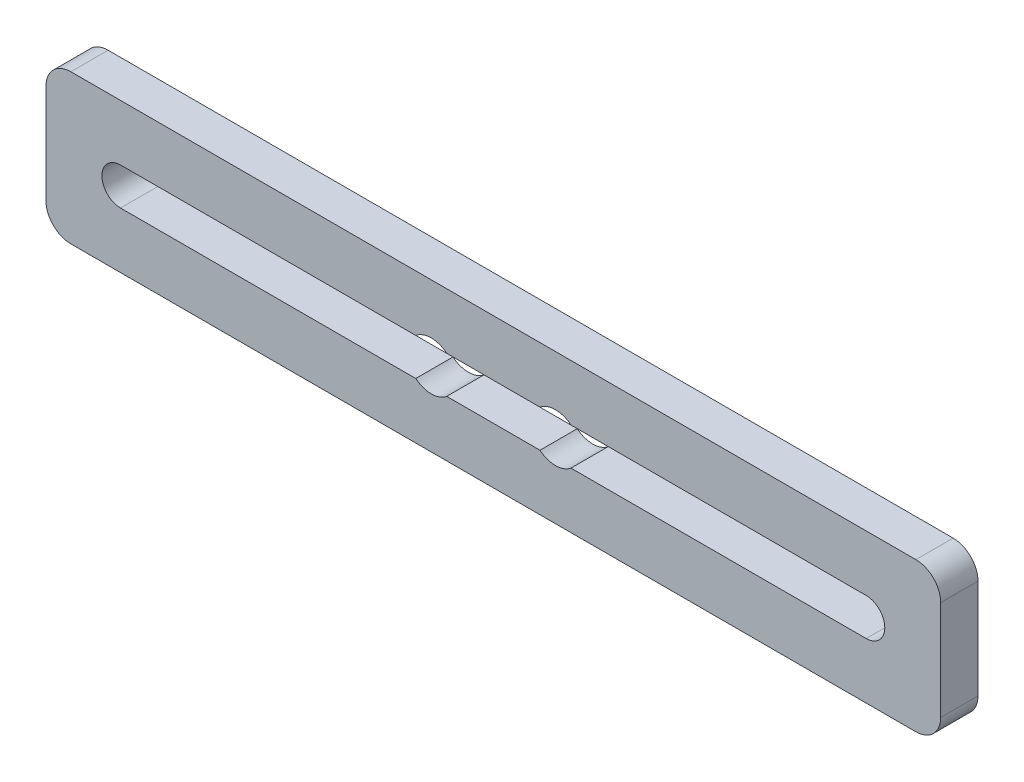
from build123d import *

# Parameters (mm, degrees)
SKETCH_1_W          = 72
SKETCH_1_H          = 12
EXTRUDE_1_DEPTH     = 3
CUT_EXTRUDE_1_DEPTH = 74.054773971
SKETCH_3_R          = 1.95
CUT_EXTRUDE_2_DEPTH = 74.054773971
FILLET_1_R          = 2


with BuildPart() as part:
    # 草图1 → 凸台-拉伸1 (new body)
    with BuildSketch(Plane.XY):
        with Locations((36, -6)):
            Rectangle(SKETCH_1_W, SKETCH_1_H)
    extrude(amount=EXTRUDE_1_DEPTH)

    # 草图2 → 切除-拉伸1 (cut, through all)
    with BuildSketch(Plane.XY.offset(3)):
        with BuildLine():
            Line((6, -4.5), (66, -4.5))
            ThreePointArc((66, -4.5), (67.5, -6), (66, -7.5))
            Line((66, -7.5), (6, -7.5))
            ThreePointArc((6, -7.5), (4.5, -6), (6, -4.5))
        make_face()
    extrude(amount=-CUT_EXTRUDE_1_DEPTH, mode=Mode.SUBTRACT)

    # 草图3 → 切除-拉伸2 (cut, through all)
    with BuildSketch(Plane.XY.offset(3)):
        with Locations((41, -6)):
            Circle(SKETCH_3_R)
        with Locations((31, -6)):
            Circle(SKETCH_3_R)
    extrude(amount=-CUT_EXTRUDE_2_DEPTH, mode=Mode.SUBTRACT)

    # 圆角1
    fillet_1_edges = [part.edges().sort_by_distance(p)[0] for p in [
        (0, 0, 1.5),
        (72, 0, 1.5),
        (72, -12, 1.5),
        (0, -12, 1.5),
    ]]
    fillet(fillet_1_edges, radius=FILLET_1_R)


solid = part.part
